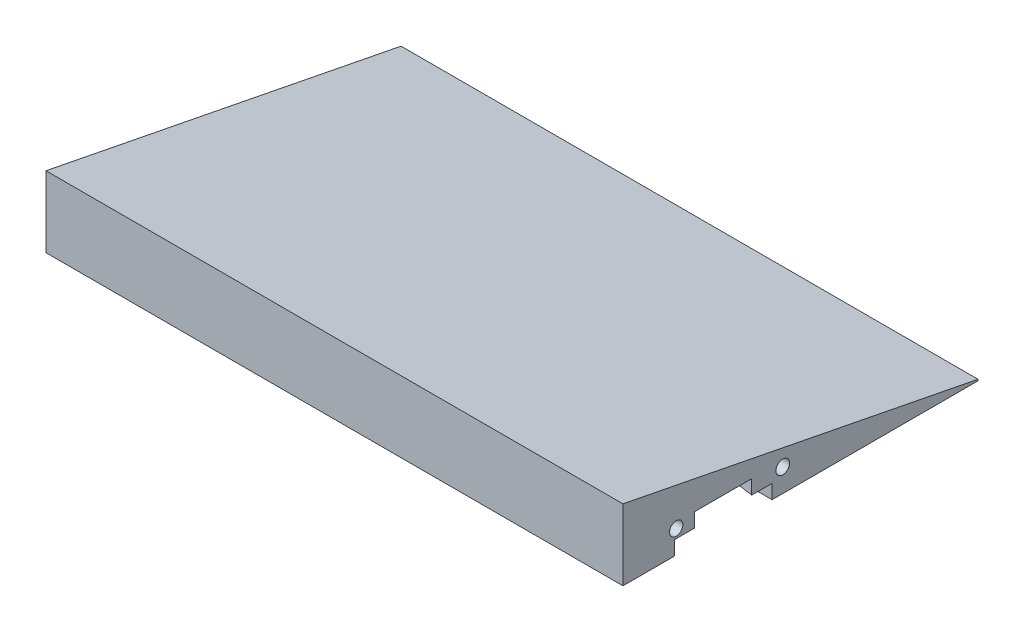
from build123d import *

# Parameters (mm, degrees)
BOSS_EXTRUDE1_DEPTH = 195.58
SKETCH2_R           = 3.3147
CUT_EXTRUDE1_DEPTH  = 38.1
SKETCH3_W           = 27.94
SKETCH3_H           = 4.064
CUT_EXTRUDE2_DEPTH  = 405.649982083
CUT_EXTRUDE3_DEPTH  = 4.064
SKETCH7_W           = 101.6
SKETCH7_H           = 20.540040578
CUT_EXTRUDE5_DEPTH  = 226.06
CUT_EXTRUDE6_DEPTH  = 4.064
SKETCH10_R          = 1.905
SKETCH10_R_2        = 1.949893387
CUT_EXTRUDE7_DEPTH  = 12.7


with BuildPart() as part:
    # Sketch1 → Boss-Extrude1 (new, symmetric)
    with BuildSketch(Plane(origin=(0, 0, 0), x_dir=(0, 0, -1), z_dir=(1, 0, 0))):
        Polygon((0, 0), (0, 20.32), (101.6, 0.4), (101.6, 0), align=None)
    extrude(amount=BOSS_EXTRUDE1_DEPTH, both=True)

    # Sketch2 → Cut-Extrude1 (cut)
    with BuildSketch(Plane(origin=(195.58, 0, 0), x_dir=(0, 0, -1), z_dir=(1, 0, 0))):
        with Locations((9.652, 3.81)):
            Circle(SKETCH2_R)
        with Locations((47.752, 3.81)):
            Circle(SKETCH2_R)
    cut_extrude1 = extrude(amount=-CUT_EXTRUDE1_DEPTH, mode=Mode.SUBTRACT)

    # Mirror3: Cut-Extrude1 across plane
    add(cut_extrude1.mirror(Plane(origin=(0, 0, 0), x_dir=(0, 0, 1), z_dir=(1, 0, 0))), mode=Mode.SUBTRACT)

    # Sketch3 → Cut-Extrude2 (cut, through all)
    with BuildSketch(Plane.ZY.offset(195.58)):
        with Locations((-28.702, 2.032)):
            Rectangle(SKETCH3_W, SKETCH3_H)
    extrude(amount=-CUT_EXTRUDE2_DEPTH, mode=Mode.SUBTRACT)

    # Sketch4 → Cut-Extrude3 (cut)
    with BuildSketch(Plane.XZ):
        Polygon((-144.78, -42.672), (-146.105623787, -52.104303355), (-144.78, -52.104303355), (-128.584447573, -52.104303355), (-127.258823787, -52.104303355), (-128.584447573, -42.672), align=None)
        Polygon((-77.581247573, -42.672), (-78.90687136, -52.104303355), (-77.581247573, -52.104303355), (-61.385695147, -52.104303355), (-60.06007136, -52.104303355), (-61.385695147, -42.672), align=None)
        Polygon((-10.382495147, -42.672), (-11.708118933, -52.104303355), (-10.382495147, -52.104303355), (5.81305728, -52.104303355), (7.138681067, -52.104303355), (5.81305728, -42.672), align=None)
        Polygon((56.81625728, -42.672), (55.490633493, -52.104303355), (56.81625728, -52.104303355), (73.011809707, -52.104303355), (74.337433493, -52.104303355), (73.011809707, -42.672), align=None)
        Polygon((124.015009707, -42.672), (122.68938592, -52.104303355), (124.015009707, -52.104303355), (140.210562134, -52.104303355), (141.53618592, -52.104303355), (140.210562134, -42.672), align=None)
        Polygon((124.015009707, -14.732), (140.210562134, -14.732), (141.53618592, -5.299696645), (140.210562134, -5.299696645), (124.015009707, -5.299696645), (122.68938592, -5.299696645), align=None)
        Polygon((56.81625728, -14.732), (73.011809707, -14.732), (74.337433493, -5.299696645), (73.011809707, -5.299696645), (56.81625728, -5.299696645), (55.490633493, -5.299696645), align=None)
        Polygon((-10.382495147, -14.732), (5.81305728, -14.732), (7.138681067, -5.299696645), (5.81305728, -5.299696645), (-10.382495147, -5.299696645), (-11.708118933, -5.299696645), align=None)
        Polygon((-77.581247573, -14.732), (-61.385695147, -14.732), (-60.06007136, -5.299696645), (-61.385695147, -5.299696645), (-77.581247573, -5.299696645), (-78.90687136, -5.299696645), align=None)
        Polygon((-144.78, -14.732), (-128.584447573, -14.732), (-127.258823787, -5.299696645), (-128.584447573, -5.299696645), (-144.78, -5.299696645), (-146.105623787, -5.299696645), align=None)
    extrude(amount=-CUT_EXTRUDE3_DEPTH, mode=Mode.SUBTRACT)

    # Sketch7 → Cut-Extrude5 (cut)
    with BuildSketch(Plane(origin=(195.58, 0, 0), x_dir=(0, 0, -1), z_dir=(1, 0, 0))):
        with Locations((50.8, 10.270020289)):
            Rectangle(SKETCH7_W, SKETCH7_H)
    extrude(amount=-CUT_EXTRUDE5_DEPTH, mode=Mode.SUBTRACT)

    # Sketch9 → Cut-Extrude6 (cut)
    with BuildSketch(Plane.XZ.offset(-4.064)):
        Polygon((-30.48, -20.447), (-39.912303355, -19.121376213), (-39.912303355, -38.171376213), (-30.48, -36.845752427), align=None)
    extrude(amount=-CUT_EXTRUDE6_DEPTH, mode=Mode.SUBTRACT)

    # Sketch10 → Cut-Extrude7 (cut)
    with BuildSketch(Plane(origin=(-30.48, 0, 0), x_dir=(0, 0, -1), z_dir=(1, 0, 0))):
        with Locations((15.24, 6.604)):
            Circle(SKETCH10_R)
        with Locations((45.72, 6.604)):
            Circle(SKETCH10_R_2)
    extrude(amount=-CUT_EXTRUDE7_DEPTH, mode=Mode.SUBTRACT)


solid = part.part
